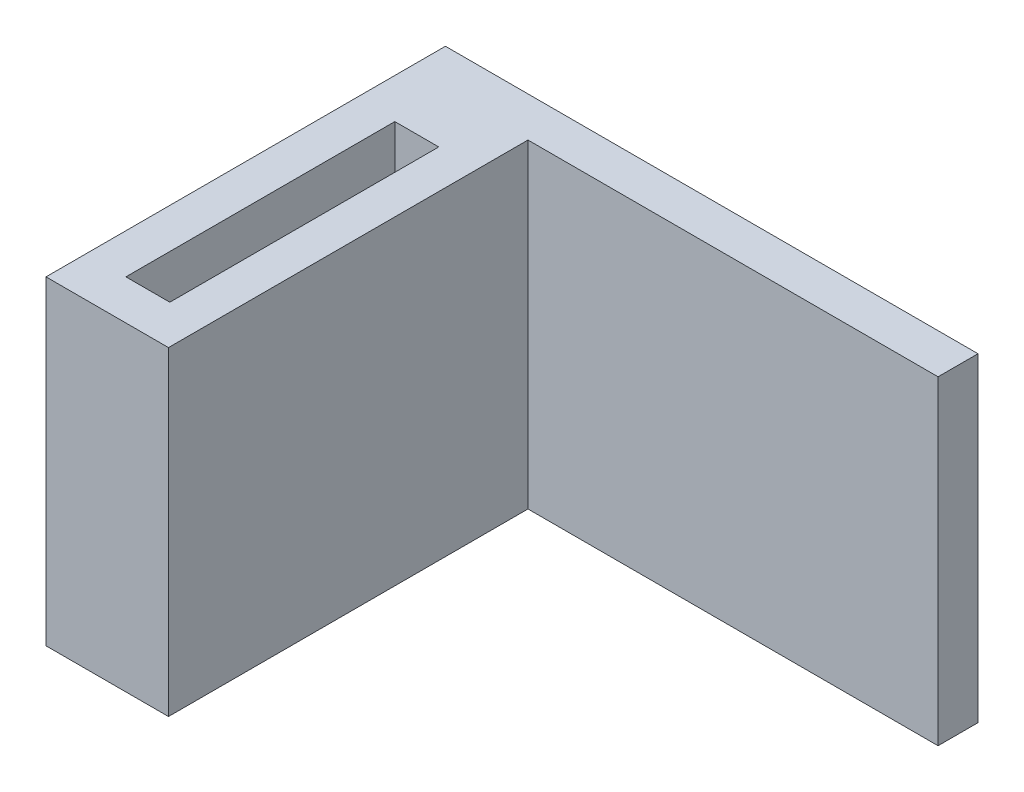
from build123d import *

# Parameters (mm, degrees)
BOSS_EXTRUDE1_DEPTH = 1.5
SKETCH1_3_W         = 1.65
SKETCH1_3_H         = 10.1
BOSS_EXTRUDE2_DEPTH = 12


with BuildPart() as part:
    # Sketch1 → Boss-Extrude1 (new body)
    with BuildSketch(Plane(origin=(0, 0, 0), x_dir=(1, 0, 0), z_dir=(0, 1, 0))):
        Polygon((0, 0), (0, 15), (20, 15), (20, 13.5), (4.6, 13.5), (4.6, 0), align=None)
    extrude(amount=BOSS_EXTRUDE1_DEPTH)

    # Sketch1<3> → Boss-Extrude2 (add)
    with BuildSketch(Plane(origin=(0, 0, 0), x_dir=(1, 0, 0), z_dir=(0, 1, 0))):
        Polygon((0, 0), (0, 15), (20, 15), (20, 13.5), (4.6, 13.5), (4.6, 0), align=None)
        with Locations((2.325, 6.55)):
            Rectangle(SKETCH1_3_W, SKETCH1_3_H, mode=Mode.SUBTRACT)
    extrude(amount=BOSS_EXTRUDE2_DEPTH)


solid = part.part
